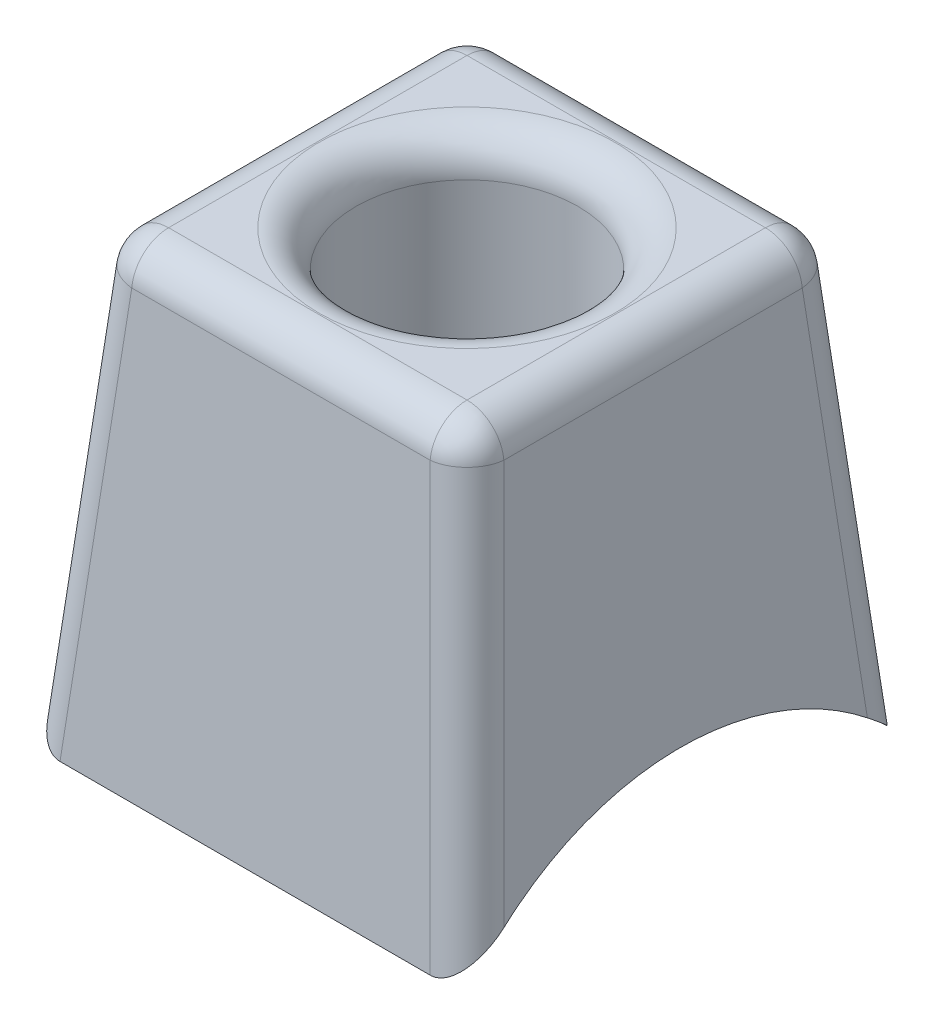
from build123d import *

# Parameters (mm, degrees)
SKETCH1_W           = 12
SKETCH1_H           = 12
BOSS_EXTRUDE1_DEPTH = 12
BOSS_EXTRUDE1_TAPER = 5
SKETCH2_R           = 3
CUT_EXTRUDE1_DEPTH  = 21.784609864
FILLET1_R           = 1
SKETCH3_R           = 8
CUT_EXTRUDE2_DEPTH  = 21.784609864


with BuildPart() as part:
    # Sketch1 → Boss-Extrude1 (new body)
    with BuildSketch(Plane(origin=(0, 0, 0), x_dir=(1, 0, 0), z_dir=(0, 1, 0))):
        with Locations((-6, 6)):
            Rectangle(SKETCH1_W, SKETCH1_H)
    extrude(amount=BOSS_EXTRUDE1_DEPTH, taper=BOSS_EXTRUDE1_TAPER)

    # Sketch2 → Cut-Extrude1 (cut, through all)
    with BuildSketch(Plane(origin=(0, 12, 0), x_dir=(1, 0, 0), z_dir=(0, 1, 0))):
        with Locations(Location((-6, 6, 0), (0, 0, 270))):
            Circle(SKETCH2_R)
    extrude(amount=-CUT_EXTRUDE1_DEPTH, mode=Mode.SUBTRACT)

    # Fillet1
    fillet1_edges = [part.edges().sort_by_distance(p)[0] for p in [
        (-10.950136038, 12, -6),
        (-6, 12, -1.049863962),
        (-6, 12, -9),
        (-1.049863962, 12, -6),
        (-6, 12, -10.950136038),
        (-0.524931981, 6, -0.524931981),
        (-11.475068019, 6, -0.524931981),
        (-11.475068019, 6, -11.475068019),
        (-0.524931981, 6, -11.475068019),
    ]]
    fillet(fillet1_edges, radius=FILLET1_R)

    # Sketch3 → Cut-Extrude2 (cut, through all)
    with BuildSketch(Plane(origin=(0, 0, 0), x_dir=(0, 0, -1), z_dir=(1, 0, 0))):
        with Locations((6, -5.291502622)):
            Circle(SKETCH3_R)
    extrude(amount=-CUT_EXTRUDE2_DEPTH, mode=Mode.SUBTRACT)


solid = part.part
